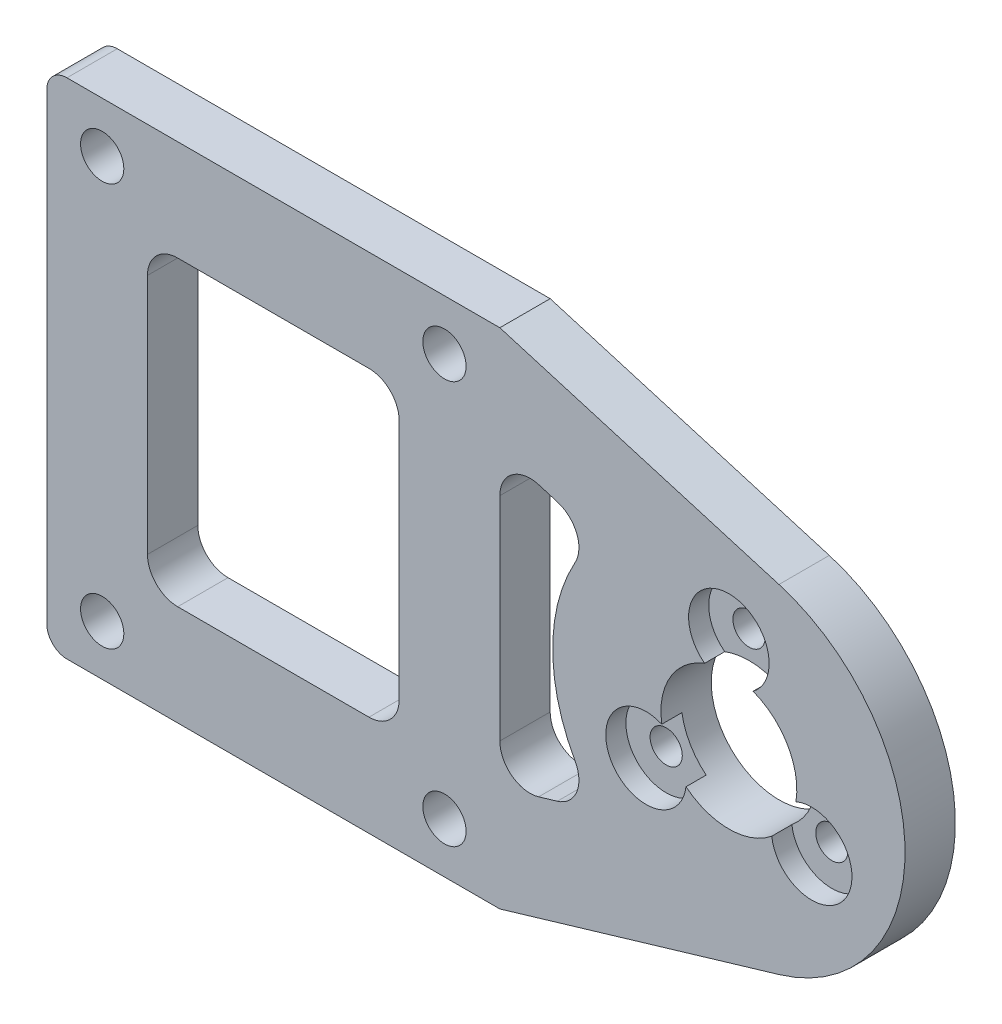
from build123d import *

# Parameters (mm, degrees)
SKETCH_1_W          = 45
SKETCH_1_H          = 50
SKETCH_1_R          = 2.15
SKETCH_1_W_2        = 25
SKETCH_1_H_2        = 30
SKETCH_1_R_2        = 17.5
SKETCH_1_R_3        = 6.75
SKETCH_1_R_4        = 1.6
EXTRUDE_1_DEPTH     = 5
CUT_EXTRUDE_START   = -2
SKETCH_2_R          = 4
SKETCH_2_R_2        = 1.6
SKETCH_2_R_3        = 6.75
CUT_EXTRUDE_1_DEPTH = 2
FILLET_2_R          = 3
FILLET_3_R          = 2


with BuildPart() as part:
    # ｽｹｯﾁ1 → ﾎﾞｽ - 押し出し1 (new body)
    # profile 1 of 4: a face of its own
    with BuildSketch(Plane.XY):
        with Locations((22.5, 25)):
            Rectangle(SKETCH_1_W, SKETCH_1_H)
        with Locations((39.5, 45)):
            Circle(SKETCH_1_R, mode=Mode.SUBTRACT)
        with Locations((5.5, 45)):
            Circle(SKETCH_1_R, mode=Mode.SUBTRACT)
        with Locations((5.5, 5)):
            Circle(SKETCH_1_R, mode=Mode.SUBTRACT)
        with Locations((39.5, 5)):
            Circle(SKETCH_1_R, mode=Mode.SUBTRACT)
        with Locations((22.5, 25)):
            Rectangle(SKETCH_1_W_2, SKETCH_1_H_2, mode=Mode.SUBTRACT)
    # profile 2 of 4: a face of its own
    with BuildSketch(Plane.XY):
        with Locations((67.75, 25)):
            Circle(SKETCH_1_R_2)
        with Locations((67.75, 25)):
            Circle(SKETCH_1_R_3, mode=Mode.SUBTRACT)
        with Locations((67.75, 34.5)):
            Circle(SKETCH_1_R_4, mode=Mode.SUBTRACT)
        with Locations((75.977241336, 20.25)):
            Circle(SKETCH_1_R_4, mode=Mode.SUBTRACT)
        with Locations((59.522758664, 20.25)):
            Circle(SKETCH_1_R_4, mode=Mode.SUBTRACT)
    # profile 3 of 4: a face of its own
    with BuildSketch(Plane.XY):
        with BuildLine():
            Line((72.725574461, 41.77777276), (45, 50))
            Line((45, 50), (45, 39.569533304))
            Line((45, 39.569533304), (54.723538773, 36.685944887))
            ThreePointArc((54.723538773, 36.685944887), (62.987031157, 41.839362452), (72.725574461, 41.77777276))
        make_face()
    # profile 4 of 4: a face of its own
    with BuildSketch(Plane.XY):
        with BuildLine():
            Line((45, 10.430466696), (45, 0))
            Line((45, 0), (72.725574461, 8.22222724))
            ThreePointArc((72.725574461, 8.22222724), (62.987031157, 8.160637548), (54.723538773, 13.314055113))
            Line((54.723538773, 13.314055113), (45, 10.430466696))
        make_face()
    extrude(amount=EXTRUDE_1_DEPTH)

    # ｽｹｯﾁ2 → ｶｯﾄ - 押し出し1 (cut)
    # profile 1 of 6: a face of its own
    with BuildSketch(Plane.XY.offset(5).offset(CUT_EXTRUDE_START)):
        with Locations((67.75, 34.5)):
            Circle(SKETCH_2_R)
        with Locations((67.75, 34.5)):
            Circle(SKETCH_2_R_2, mode=Mode.SUBTRACT)
    # profile 2 of 6: a face of its own
    with BuildSketch(Plane.XY.offset(5).offset(CUT_EXTRUDE_START)):
        with Locations(Location((67.75, 25, 0), (0, 0, 189.100972034))):
            Circle(SKETCH_2_R_3)
    # profile 3 of 6: a face of its own
    with BuildSketch(Plane.XY.offset(5).offset(CUT_EXTRUDE_START)):
        with Locations(Location((67.75, 25, 0), (0, 0, 189.100972034))):
            Circle(SKETCH_2_R_3)
    # profile 4 of 6: a face of its own
    with BuildSketch(Plane.XY.offset(5).offset(CUT_EXTRUDE_START)):
        with Locations((59.522758664, 20.25)):
            Circle(SKETCH_2_R)
        with Locations((59.522758664, 20.25)):
            Circle(SKETCH_2_R_2, mode=Mode.SUBTRACT)
    # profile 5 of 6: a face of its own
    with BuildSketch(Plane.XY.offset(5).offset(CUT_EXTRUDE_START)):
        with Locations(Location((67.75, 25, 0), (0, 0, 189.100972034))):
            Circle(SKETCH_2_R_3)
    # profile 6 of 6: a face of its own
    with BuildSketch(Plane.XY.offset(5).offset(CUT_EXTRUDE_START)):
        with Locations((75.977241336, 20.25)):
            Circle(SKETCH_2_R)
        with Locations((75.977241336, 20.25)):
            Circle(SKETCH_2_R_2, mode=Mode.SUBTRACT)
    extrude(amount=CUT_EXTRUDE_1_DEPTH, mode=Mode.SUBTRACT)

    # ﾌｨﾚｯﾄ2
    fillet_2_edges = [part.edges().sort_by_distance(p)[0] for p in [
        (35, 40, 2.5),
        (10, 40, 2.5),
        (10, 10, 2.5),
        (35, 10, 2.5),
        (45, 39.569533304, 2.5),
        (45, 10.430466696, 2.5),
        (54.723538773, 13.314055113, 2.5),
        (54.723538773, 36.685944887, 2.5),
    ]]
    fillet(fillet_2_edges, radius=FILLET_2_R)

    # ﾌｨﾚｯﾄ3
    fillet_3_edges = [part.edges().sort_by_distance(p)[0] for p in [
        (0, 0, 2.5),
        (0, 50, 2.5),
    ]]
    fillet(fillet_3_edges, radius=FILLET_3_R)


solid = part.part
